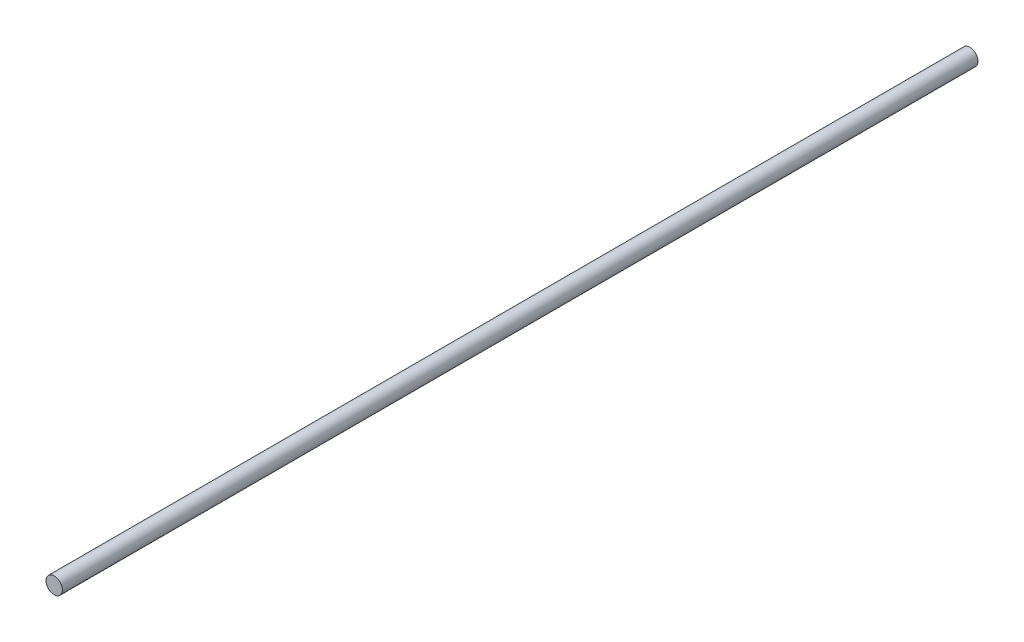
from build123d import *

# Parameters (mm, degrees)
SKETCH1_R           = 1.5875
BOSS_EXTRUDE1_DEPTH = 177.8


with BuildPart() as part:
    # Sketch1 → Boss-Extrude1 (new body)
    with BuildSketch(Plane.XY):
        Circle(SKETCH1_R)
    extrude(amount=BOSS_EXTRUDE1_DEPTH)


solid = part.part
